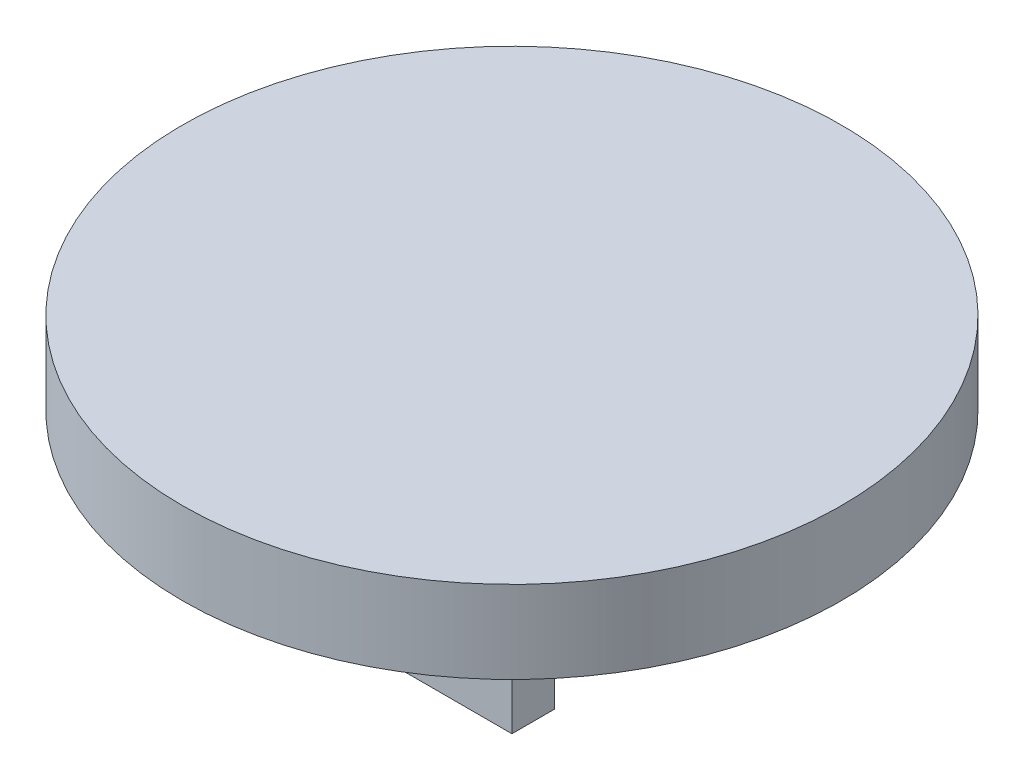
from build123d import *

# Parameters (mm, degrees)
SKETCH1_R           = 12
BOSS_EXTRUDE1_DEPTH = 3
SKETCH3_W           = 10
SKETCH3_H           = 10
BOSS_EXTRUDE3_DEPTH = 3
SKETCH4_R           = 0.5
CUT_EXTRUDE1_DEPTH  = 9
SKETCH5_W           = 3.622801716
SKETCH5_H           = 3
CUT_EXTRUDE2_DEPTH  = 9
BOSS_EXTRUDE5_REACH = 23.024
SKETCH6_W           = 7.376723675
SKETCH6_H           = 5.195198294
SKETCH7_R           = 0.5
CUT_EXTRUDE3_DEPTH  = 14
SKETCH8_W           = 3.773751788
SKETCH8_H           = 4.487553498
CUT_EXTRUDE4_DEPTH  = 22.447379451
SKETCH9_W           = 10
SKETCH9_H           = 6.886875894
CUT_EXTRUDE5_DEPTH  = 5


with BuildPart() as part:
    # Sketch1 → Boss-Extrude1 (new body)
    with BuildSketch(Plane(origin=(0, 0, 0), x_dir=(1, 0, 0), z_dir=(0, 1, 0))):
        with Locations(Location((0, 0, 0), (0, 0, 270))):
            Circle(SKETCH1_R)
    extrude(amount=BOSS_EXTRUDE1_DEPTH)

    # Sketch3 → Boss-Extrude3 (add)
    with BuildSketch(Plane.XZ):
        Rectangle(SKETCH3_W, SKETCH3_H)
    extrude(amount=BOSS_EXTRUDE3_DEPTH)

    # Sketch4 → Cut-Extrude1 (cut)
    with BuildSketch(Plane(origin=(0, 0, -5), x_dir=(-1, 0, 0), z_dir=(0, 0, -1))):
        with Locations((0, -1.5)):
            Circle(SKETCH4_R)
    extrude(amount=-CUT_EXTRUDE1_DEPTH, mode=Mode.SUBTRACT)

    # Sketch5 → Cut-Extrude2 (cut)
    with BuildSketch(Plane(origin=(5, 0, 0), x_dir=(0, 0, -1), z_dir=(1, 0, 0))):
        with Locations((0, -1.5)):
            Rectangle(SKETCH5_W, SKETCH5_H)
    extrude(amount=-CUT_EXTRUDE2_DEPTH, mode=Mode.SUBTRACT)

    # Boss-Extrude5: up to this face of the body (flat: up to its plane)
    boss_extrude5_end = Plane(part.part.faces().sort_by_distance((0, -1.5, 5))[0])
    # Sketch6 → Boss-Extrude5 (add, up to the picked face)
    with BuildSketch(Plane(origin=(0, 0, -5), x_dir=(-1, 0, 0), z_dir=(0, 0, -1)), mode=Mode.PRIVATE) as boss_extrude5_sk1:
        with Locations((-1.311638162, -2.597599147)):
            Rectangle(SKETCH6_W, SKETCH6_H)
    boss_extrude5_tool1 = split(extrude(boss_extrude5_sk1.sketch, amount=-BOSS_EXTRUDE5_REACH, mode=Mode.PRIVATE), bisect_by=boss_extrude5_end, keep=Keep.BOTH, mode=Mode.PRIVATE)
    add(boss_extrude5_tool1.solids().sort_by(Axis((1.311638, -2.597599, -5), (0, 0, 1)))[0])

    # Sketch7 → Cut-Extrude3 (cut)
    with BuildSketch(Plane.XY.offset(5)):
        with Locations((0, -3.072529249)):
            Circle(SKETCH7_R)
    extrude(amount=-CUT_EXTRUDE3_DEPTH, mode=Mode.SUBTRACT)

    # Sketch8 → Cut-Extrude4 (cut, through all)
    with BuildSketch(Plane.ZY.offset(5)):
        with Locations((0, -2.951421545)):
            Rectangle(SKETCH8_W, SKETCH8_H)
    extrude(amount=-CUT_EXTRUDE4_DEPTH, mode=Mode.SUBTRACT)

    # Sketch9 → Cut-Extrude5 (cut)
    with BuildSketch(Plane.XZ.offset(5.195198294)):
        Rectangle(SKETCH9_W, SKETCH9_H)
    extrude(amount=-CUT_EXTRUDE5_DEPTH, mode=Mode.SUBTRACT)


solid = part.part
